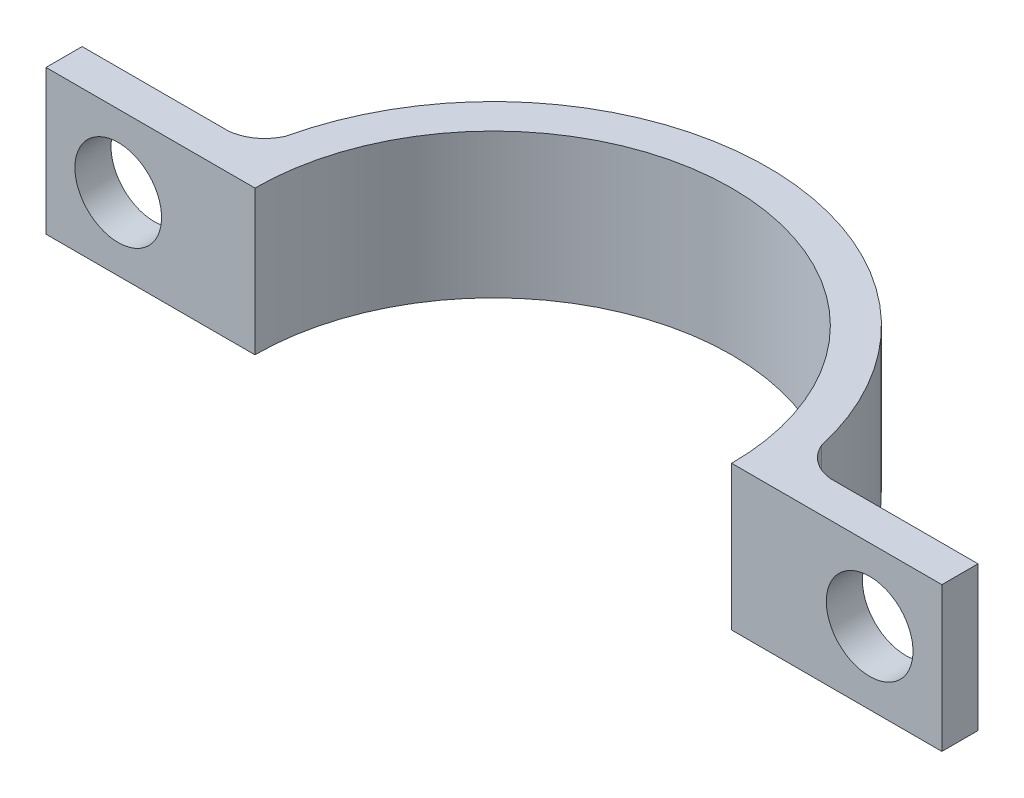
from build123d import *

# Parameters (mm, degrees)
BOSS_EXTRUDE1_DEPTH = 10
SKETCH2_R           = 3
CUT_EXTRUDE1_DEPTH  = 8


with BuildPart() as part:
    # Sketch1 → Boss-Extrude1 (new body)
    with BuildSketch(Plane(origin=(0, 0, 0), x_dir=(1, 0, 0), z_dir=(0, 1, 0))):
        with BuildLine():
            Line((-14.70271565, -10.052675371), (-29.165444207, -10.052675371))
            Line((-29.165444207, -10.052675371), (-29.165444207, -7.552675371))
            Line((-29.165444207, -7.552675371), (-19.04460375, -7.552675371))
            ThreePointArc((-19.04460375, -7.552675371), (-17.652378747, -7.021091902), (-16.731881464, -5.849103764))
            ThreePointArc((-16.731881464, -5.849103764), (1.79728435, 8.947324629), (20.326450163, -5.849103764))
            ThreePointArc((20.326450163, -5.849103764), (21.246947447, -7.021091902), (22.63917245, -7.552675371))
            Line((22.63917245, -7.552675371), (32.849946683, -7.552675371))
            Line((32.849946683, -7.552675371), (32.849946683, -10.052675371))
            Line((32.849946683, -10.052675371), (18.29728435, -10.052675371))
            ThreePointArc((18.29728435, -10.052675371), (1.79728435, 6.447324629), (-14.70271565, -10.052675371))
        make_face()
    extrude(amount=BOSS_EXTRUDE1_DEPTH)

    # Sketch2 → Cut-Extrude1 (cut)
    with BuildSketch(Plane(origin=(0, 0, 7.552675371), x_dir=(-1, 0, 0), z_dir=(0, 0, -1))):
        with Locations((24.165444207, 5)):
            Circle(SKETCH2_R)
        with Locations((-27.849946683, 5)):
            Circle(SKETCH2_R)
    extrude(amount=-CUT_EXTRUDE1_DEPTH, mode=Mode.SUBTRACT)


solid = part.part
